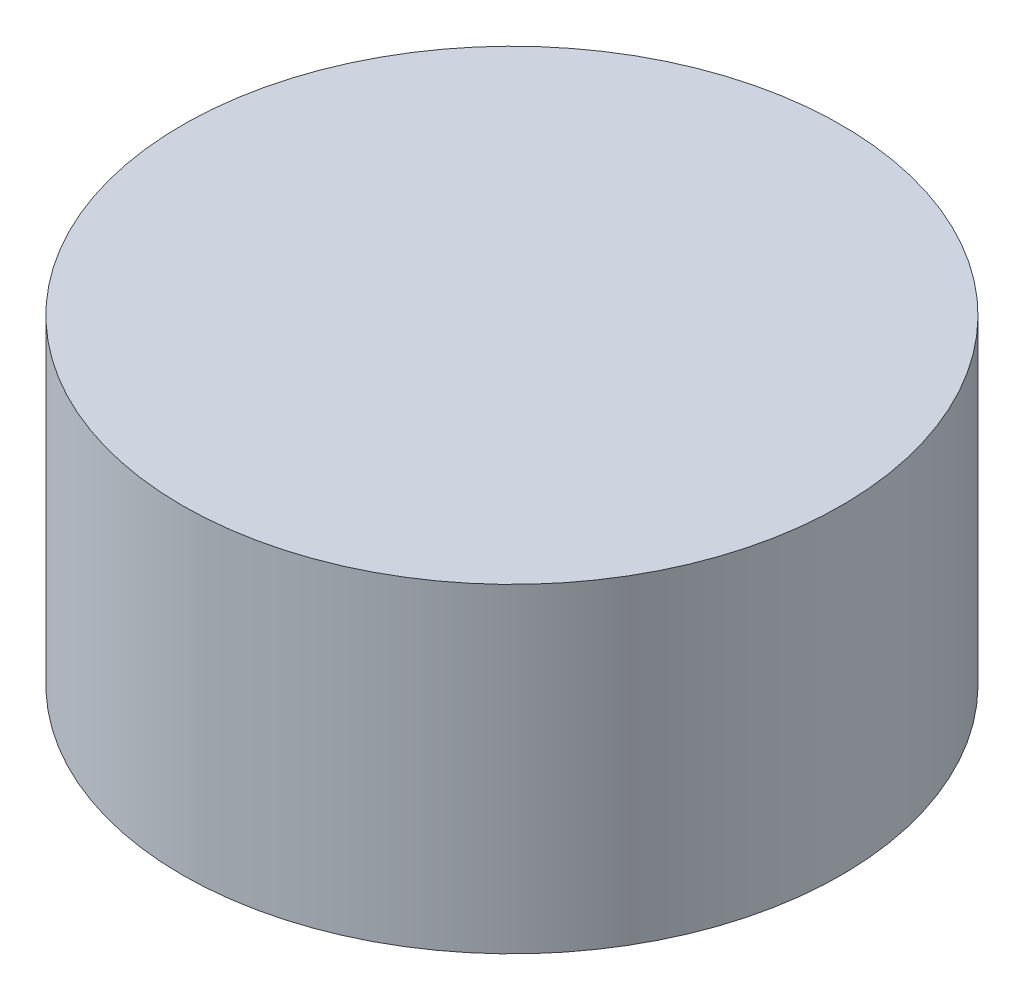
from build123d import *

# Parameters (mm, degrees)
ESQUISSE1_R        = 30.9
BOSS_EXTRU_1_DEPTH = 30


with BuildPart() as part:
    # Esquisse1 → Boss.-Extru.1 (new body)
    with BuildSketch(Plane(origin=(0, 0, 0), x_dir=(1, 0, 0), z_dir=(0, 1, 0))):
        with Locations(Location((0, 0, 0), (0, 0, 270))):
            Circle(ESQUISSE1_R)
    extrude(amount=BOSS_EXTRU_1_DEPTH)


solid = part.part
